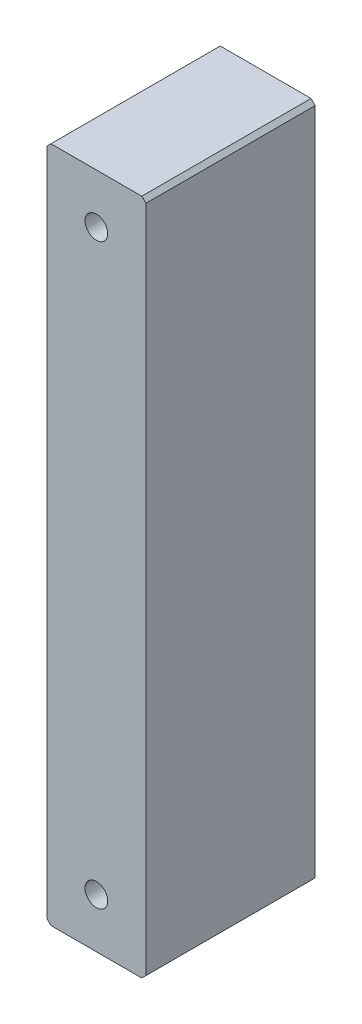
from build123d import *

# Parameters (mm, degrees)
CROQUIS2_R              = 2.75
SALIENTE_EXTRUIR1_DEPTH = 41


with BuildPart() as part:
    # Croquis2 → Saliente-Extruir1 (new body)
    with BuildSketch(Plane.XY):
        Polygon((-592.282716973, 986.418944407), (-591.282716973, 987.418944407), (-569.282716973, 987.418944407), (-568.282716973, 986.418944407), (-568.282716973, 824.418944407), (-569.282716973, 823.418944407), (-591.282716973, 823.418944407), (-592.282716973, 824.418944407), align=None)
        with Locations((-580.282716973, 975.418944407)):
            Circle(CROQUIS2_R, mode=Mode.SUBTRACT)
        with Locations((-580.282716973, 835.418944407)):
            Circle(CROQUIS2_R, mode=Mode.SUBTRACT)
    extrude(amount=SALIENTE_EXTRUIR1_DEPTH)


solid = part.part
